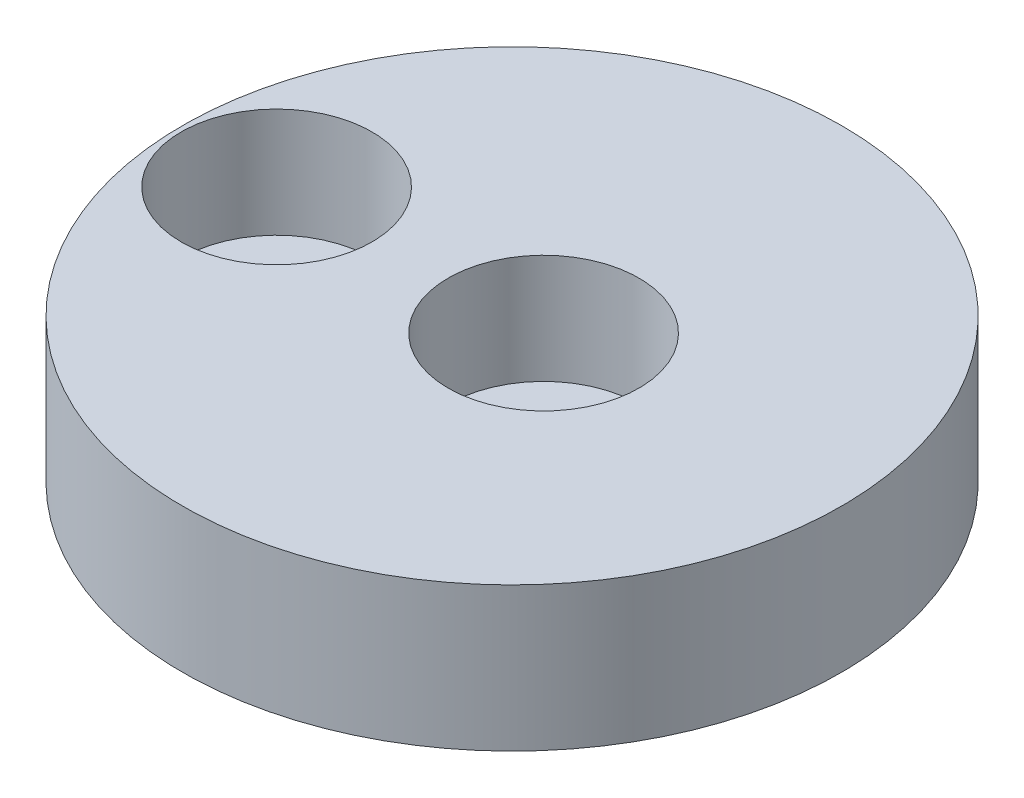
from build123d import *

# Parameters (mm, degrees)
SZKIC1_R                        = 19
DODANIE_WYCI_GNI_CIE1_DEPTH     = 8.3
WYTNIJ_WYCI_GNI_CIE1_DEPTH      = 1036.988363246
WYTNIJ_WYCI_GNI_CIE1_DEPTH_BACK = 1036.988363246
SZKIC2_R                        = 3
WYTNIJ_WYCI_GNI_CIE2_START      = 8.3
SZKIC3_R                        = 5.5
WYTNIJ_WYCI_GNI_CIE2_DEPTH      = 6.3


with BuildPart() as part:
    # Szkic1 → Dodanie-wyciągnięcie1 (new body)
    with BuildSketch(Plane(origin=(0, 0, 0), x_dir=(1, 0, 0), z_dir=(0, 1, 0))):
        with Locations(Location((0, 0, 0), (0, 0, 90))):
            Circle(SZKIC1_R)
    extrude(amount=DODANIE_WYCI_GNI_CIE1_DEPTH)

    # Szkic2 → Wytnij-wyciągnięcie1 (cut, two sides: drawn at the far end of the back side and taken through both)
    with BuildSketch(Plane(origin=(141.849854944, -17.369665232, -1004.103260298), x_dir=(0.9996501322683511, 0, -0.02645019954306737), z_dir=(0, 1, 0)).offset(-WYTNIJ_WYCI_GNI_CIE1_DEPTH_BACK)):
        with Locations(Location((-181.587823501, -1000, 0), (0, 0, 268.484338434))):
            Circle(SZKIC2_R)
        with Locations(Location((-166.587823501, -1000, 0), (0, 0, 268.484338434))):
            Circle(SZKIC2_R)
    extrude(amount=WYTNIJ_WYCI_GNI_CIE1_DEPTH + WYTNIJ_WYCI_GNI_CIE1_DEPTH_BACK, mode=Mode.SUBTRACT)

    # Szkic3 → Wytnij-wyciągnięcie2 (cut)
    with BuildSketch(Plane(origin=(0, 0, 0), x_dir=(1, 0, 0), z_dir=(0, 1, 0)).offset(WYTNIJ_WYCI_GNI_CIE2_START)):
        with Locations(Location((-13.224237294, -0.349906136, 0), (0, 0, 270))):
            Circle(SZKIC3_R)
        with Locations(Location((1.77051469, 0.046846857, 0), (0, 0, 270))):
            Circle(SZKIC3_R)
    extrude(amount=-WYTNIJ_WYCI_GNI_CIE2_DEPTH, mode=Mode.SUBTRACT)


solid = part.part
